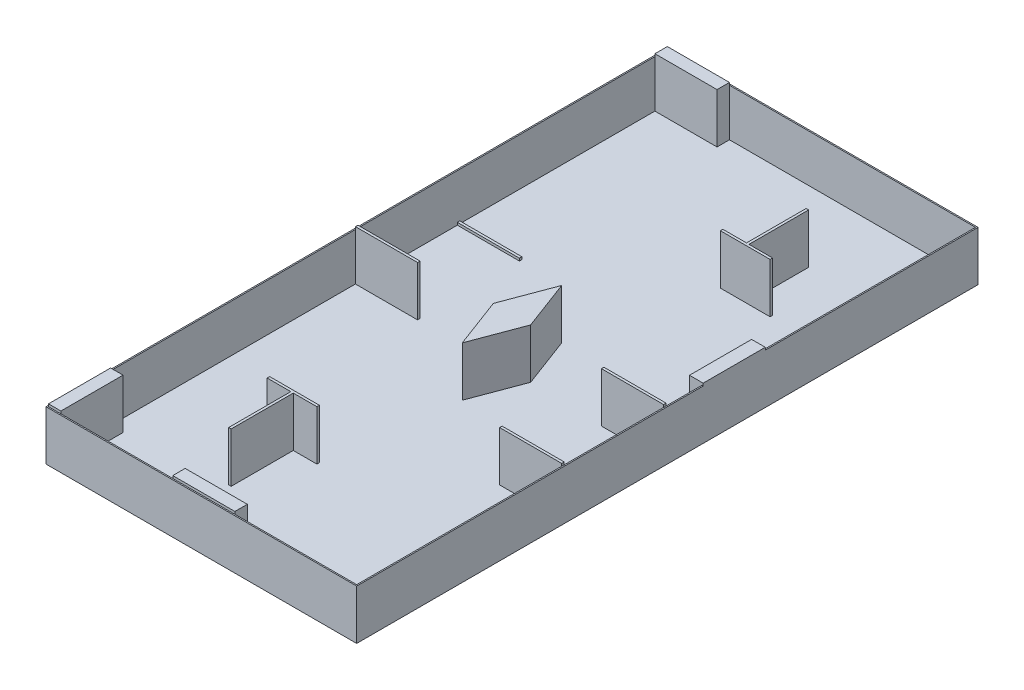
from build123d import *

# Parameters (mm, degrees)
SKETCH1_W            = 1250
SKETCH1_H            = 2500
BOSS_EXTRUDE1_DEPTH  = 200
SKETCH2_W            = 1240
SKETCH2_H            = 2490
CUT_EXTRUDE1_DEPTH   = 190
BOSS_EXTRUDE2_DEPTH  = 200
SKETCH8_W            = 10
SKETCH8_H            = 250
BOSS_EXTRUDE3_DEPTH  = 200
SKETCH10_W           = 250
SKETCH10_H           = 10
BOSS_EXTRUDE4_DEPTH  = 200
BOSS_EXTRUDE8_DEPTH  = 200
SKETCH11_W           = 250
SKETCH11_H           = 10
BOSS_EXTRUDE5_DEPTH  = 200
SKETCH12_W           = 250
SKETCH12_H           = 10
BOSS_EXTRUDE6_DEPTH  = 200
SKETCH18_W           = 250
SKETCH18_H           = 10
BOSS_EXTRUDE9_DEPTH  = 10
BOSS_EXTRUDE10_DEPTH = 200
SKETCH23_W           = 50
SKETCH23_H           = 250
BOSS_EXTRUDE11_DEPTH = 200
SKETCH24_W           = 250
SKETCH24_H           = 50
BOSS_EXTRUDE12_DEPTH = 200
SKETCH25_W           = 250
SKETCH25_H           = 50
BOSS_EXTRUDE13_DEPTH = 200
SKETCH26_W           = 55
SKETCH26_H           = 250
BOSS_EXTRUDE14_DEPTH = 200


with BuildPart() as part:
    # Sketch1 → Boss-Extrude1 (new body)
    with BuildSketch(Plane(origin=(0, 0, 0), x_dir=(1, 0, 0), z_dir=(0, 1, 0))):
        Rectangle(SKETCH1_W, SKETCH1_H)
    extrude(amount=BOSS_EXTRUDE1_DEPTH)

    # Sketch2 → Cut-Extrude1 (cut)
    with BuildSketch(Plane(origin=(0, 200, 0), x_dir=(1, 0, 0), z_dir=(0, 1, 0))):
        Rectangle(SKETCH2_W, SKETCH2_H)
    extrude(amount=-CUT_EXTRUDE1_DEPTH, mode=Mode.SUBTRACT)

    # Sketch7 → Boss-Extrude2 (add)
    with BuildSketch(Plane(origin=(0, 10, 0), x_dir=(1, 0, 0), z_dir=(0, 1, 0))):
        Polygon((-170, -705), (-270, -705), (-270, -715), (-117.906694844, -715), (-70, -715), (-70, -705), align=None)
    extrude(amount=BOSS_EXTRUDE2_DEPTH)

    # Sketch8 → Boss-Extrude3 (add)
    with BuildSketch(Plane(origin=(0, 10, 0), x_dir=(1, 0, 0), z_dir=(0, 1, 0))):
        with Locations((-170, -840)):
            Rectangle(SKETCH8_W, SKETCH8_H)
    extrude(amount=BOSS_EXTRUDE3_DEPTH)

    # Sketch10 → Boss-Extrude4 (add)
    with BuildSketch(Plane(origin=(0, 10, 0), x_dir=(1, 0, 0), z_dir=(0, 1, 0))):
        with Locations((-495, -5)):
            Rectangle(SKETCH10_W, SKETCH10_H)
    extrude(amount=BOSS_EXTRUDE4_DEPTH)

    # Sketch17 → Boss-Extrude8 (add)
    with BuildSketch(Plane(origin=(0, 10, 0), x_dir=(1, 0, 0), z_dir=(0, 1, 0))):
        Polygon((0, 200), (-75, 0), (0, -200), (75, 0), align=None)
    extrude(amount=BOSS_EXTRUDE8_DEPTH)

    # Sketch11 → Boss-Extrude5 (add)
    with BuildSketch(Plane(origin=(0, 10, 0), x_dir=(1, 0, 0), z_dir=(0, 1, 0))):
        with Locations((495, -5)):
            Rectangle(SKETCH11_W, SKETCH11_H)
    extrude(amount=BOSS_EXTRUDE5_DEPTH)

    # Sketch12 → Boss-Extrude6 (add)
    with BuildSketch(Plane(origin=(0, 10, 0), x_dir=(1, 0, 0), z_dir=(0, 1, 0))):
        with Locations((495, -415)):
            Rectangle(SKETCH12_W, SKETCH12_H)
    extrude(amount=BOSS_EXTRUDE6_DEPTH)

    # Sketch18 → Boss-Extrude9 (add)
    with BuildSketch(Plane(origin=(0, 10, 0), x_dir=(1, 0, 0), z_dir=(0, 1, 0))):
        with Locations((-495, 405)):
            Rectangle(SKETCH18_W, SKETCH18_H)
    extrude(amount=BOSS_EXTRUDE9_DEPTH)

    # Sketch21 → Boss-Extrude10 (add)
    with BuildSketch(Plane(origin=(0, 10, 0), x_dir=(1, 0, 0), z_dir=(0, 1, 0))):
        Polygon((170, 710), (328.507885592, 710), (328.507885592, 720), (233.507885592, 720), (233.507885592, 960), (223.507885592, 960), (223.507885592, 720), (128.507885592, 720), (128.507885592, 710), align=None)
    extrude(amount=BOSS_EXTRUDE10_DEPTH)

    # Sketch23 → Boss-Extrude11 (add)
    with BuildSketch(Plane(origin=(0, 10, 0), x_dir=(1, 0, 0), z_dir=(0, 1, 0))):
        with Locations((-595, -1120)):
            Rectangle(SKETCH23_W, SKETCH23_H)
    extrude(amount=BOSS_EXTRUDE11_DEPTH)

    # Sketch24 → Boss-Extrude12 (add)
    with BuildSketch(Plane(origin=(0, 10, 0), x_dir=(1, 0, 0), z_dir=(0, 1, 0))):
        with Locations((5, -1220)):
            Rectangle(SKETCH24_W, SKETCH24_H)
    extrude(amount=BOSS_EXTRUDE12_DEPTH)

    # Sketch25 → Boss-Extrude13 (add)
    with BuildSketch(Plane(origin=(0, 10, 0), x_dir=(1, 0, 0), z_dir=(0, 1, 0))):
        with Locations((-495, 1220)):
            Rectangle(SKETCH25_W, SKETCH25_H)
    extrude(amount=BOSS_EXTRUDE13_DEPTH)

    # Sketch26 → Boss-Extrude14 (add)
    with BuildSketch(Plane(origin=(0, 10, 0), x_dir=(1, 0, 0), z_dir=(0, 1, 0))):
        with Locations((597.5, 269.101726834)):
            Rectangle(SKETCH26_W, SKETCH26_H)
    extrude(amount=BOSS_EXTRUDE14_DEPTH)


solid = part.part
